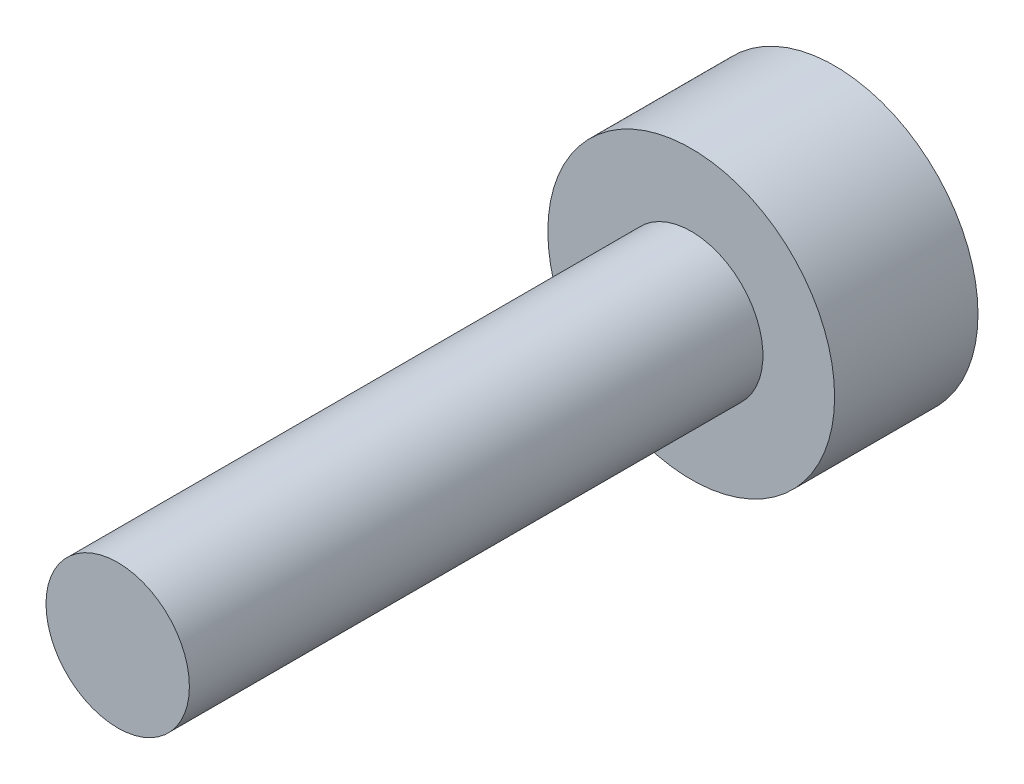
from build123d import *

# Parameters (mm, degrees)
SKETCH_1_R      = 1.5
EXTRUDE_1_DEPTH = 12
SKETCH_3_R      = 3
EXTRUDE_2_DEPTH = 3


with BuildPart() as part:
    # 草图1 → 凸台-拉伸1 (new body)
    with BuildSketch(Plane.XY):
        Circle(SKETCH_1_R)
    extrude(amount=EXTRUDE_1_DEPTH)

    # 草图3 → 凸台-拉伸2 (add)
    with BuildSketch(Plane(origin=(0, 0, 0), x_dir=(-1, 0, 0), z_dir=(0, 0, -1))):
        Circle(SKETCH_3_R)
    extrude(amount=EXTRUDE_2_DEPTH)


solid = part.part
